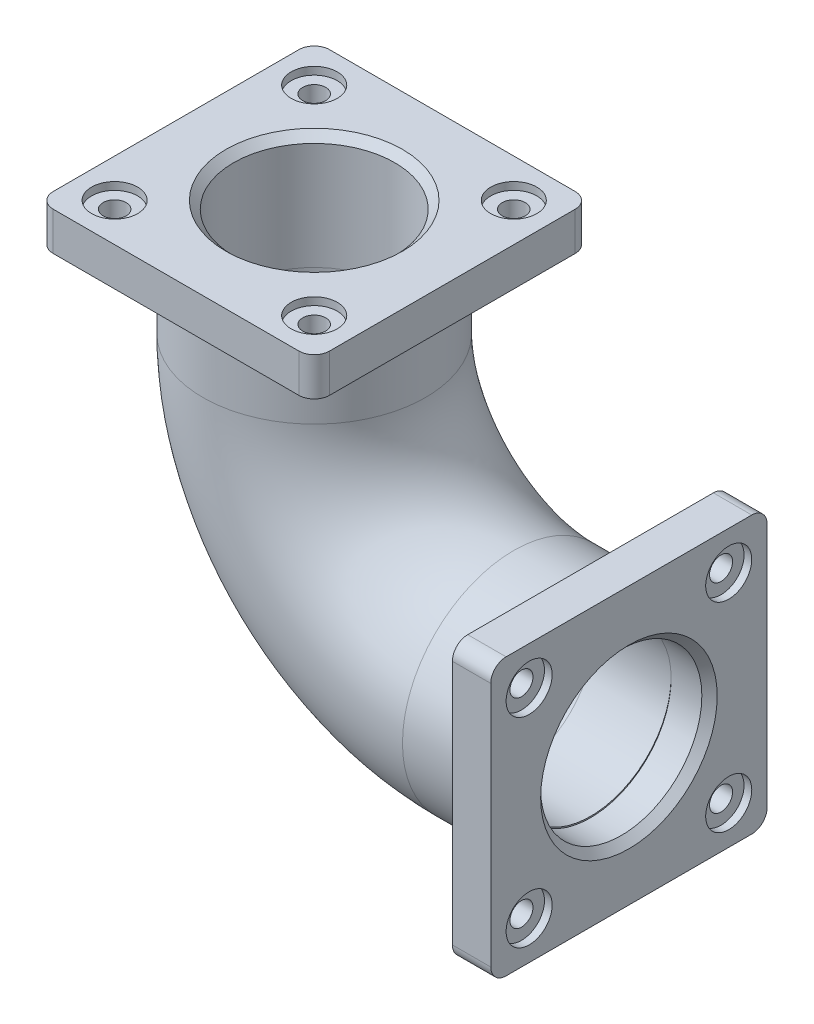
from build123d import *

# Parameters (mm, degrees)
SKETCH2_R           = 145
SKETCH2_R_2         = 105
SKETCH6_R           = 15
BOSS_EXTRUDE1_DEPTH = 50
SKETCH7_R           = 105
CUT_EXTRUDE1_DEPTH  = 50
SKETCH9_W           = 360
SKETCH9_H           = 360
SKETCH9_R           = 15
BOSS_EXTRUDE3_DEPTH = 50
SKETCH10_R          = 30
CUT_EXTRUDE3_DEPTH  = 10
SKETCH11_R          = 30
CUT_EXTRUDE4_DEPTH  = 10
FILLET2_R           = 20
FILLET3_R           = 10
SKETCH12_R          = 105
CUT_EXTRUDE5_DEPTH  = 50
CHAMFER2_SIZE       = 10


with BuildPart() as part:
    # Sweep1: sweep along a path in Sketch4
    with BuildLine(Plane.XY) as sweep1_path:
        Line((0, 0), (0, -150))
        ThreePointArc((0, -150), (76.152236891, -333.847763109), (260, -410))
        Line((260, -410), (410, -410))
    # Sketch2 → Sweep1 (sweep)
    with BuildSketch(Plane(origin=(0, 0, 0), x_dir=(1, 0, 0), z_dir=(0, 1, 0))):
        Circle(SKETCH2_R)
        Circle(SKETCH2_R_2, mode=Mode.SUBTRACT)
    sweep(path=sweep1_path.line)

    # Sketch6 → Boss-Extrude1 (add)
    with BuildSketch(Plane(origin=(0, 0, 0), x_dir=(1, 0, 0), z_dir=(0, 1, 0))):
        with BuildLine():
            Line((-160, 180), (160, 180))
            ThreePointArc((160, 180), (174.142135624, 174.142135624), (180, 160))
            Line((180, 160), (180, -160))
            ThreePointArc((180, -160), (174.142135624, -174.142135624), (160, -180))
            Line((160, -180), (-160, -180))
            ThreePointArc((-160, -180), (-174.142135624, -174.142135624), (-180, -160))
            Line((-180, -160), (-180, 160))
            ThreePointArc((-180, 160), (-174.142135624, 174.142135624), (-160, 180))
        make_face()
        with Locations(Location((-130, 130, 0), (0, 0, 270))):
            Circle(SKETCH6_R, mode=Mode.SUBTRACT)
        with Locations(Location((130, 130, 0), (0, 0, 270))):
            Circle(SKETCH6_R, mode=Mode.SUBTRACT)
        with Locations(Location((130, -130, 0), (0, 0, 270))):
            Circle(SKETCH6_R, mode=Mode.SUBTRACT)
        with Locations(Location((-130, -130, 0), (0, 0, 270))):
            Circle(SKETCH6_R, mode=Mode.SUBTRACT)
    extrude(amount=-BOSS_EXTRUDE1_DEPTH)

    # Sketch7 → Cut-Extrude1 (cut)
    with BuildSketch(Plane(origin=(0, -50, 0), x_dir=(-1, 0, 0), z_dir=(0, -1, 0))):
        with Locations(Location((0, 0, 0), (0, 0, 90))):
            Circle(SKETCH7_R)
    extrude(amount=-CUT_EXTRUDE1_DEPTH, mode=Mode.SUBTRACT)

    # Sketch9 → Boss-Extrude3 (add)
    with BuildSketch(Plane(origin=(410, 0, 0), x_dir=(0, 0, -1), z_dir=(1, 0, 0))):
        with Locations((0, -410)):
            Rectangle(SKETCH9_W, SKETCH9_H)
        with Locations((-130, -280)):
            Circle(SKETCH9_R, mode=Mode.SUBTRACT)
        with Locations((-130, -540)):
            Circle(SKETCH9_R, mode=Mode.SUBTRACT)
        with Locations((130, -540)):
            Circle(SKETCH9_R, mode=Mode.SUBTRACT)
        with Locations((130, -280)):
            Circle(SKETCH9_R, mode=Mode.SUBTRACT)
    extrude(amount=-BOSS_EXTRUDE3_DEPTH)

    # Sketch10 → Cut-Extrude3 (cut)
    with BuildSketch(Plane(origin=(0, 0, 0), x_dir=(1, 0, 0), z_dir=(0, 1, 0))):
        with Locations(Location((-130, 130, 0), (0, 0, 270))):
            Circle(SKETCH10_R)
        with Locations(Location((130, 130, 0), (0, 0, 270))):
            Circle(SKETCH10_R)
        with Locations(Location((130, -130, 0), (0, 0, 270))):
            Circle(SKETCH10_R)
        with Locations(Location((-130, -130, 0), (0, 0, 270))):
            Circle(SKETCH10_R)
    extrude(amount=-CUT_EXTRUDE3_DEPTH, mode=Mode.SUBTRACT)

    # Sketch11 → Cut-Extrude4 (cut)
    with BuildSketch(Plane(origin=(410, 0, 0), x_dir=(0, 0, -1), z_dir=(1, 0, 0))):
        with Locations((-130, -280)):
            Circle(SKETCH11_R)
        with Locations((130, -280)):
            Circle(SKETCH11_R)
        with Locations((-130, -540)):
            Circle(SKETCH11_R)
        with Locations((130, -540)):
            Circle(SKETCH11_R)
    extrude(amount=-CUT_EXTRUDE4_DEPTH, mode=Mode.SUBTRACT)

    # Fillet2
    fillet2_edges = [part.edges().sort_by_distance(p)[0] for p in [
        (385, -230, -180),
        (385, -590, -180),
        (385, -590, 180),
        (385, -230, 180),
    ]]
    fillet(fillet2_edges, radius=FILLET2_R)

    # Fillet3
    fillet3_edges = [part.edges().sort_by_distance(p)[0] for p in [
        (-145, -50, 0),
        (360, -555, 0),
    ]]
    fillet(fillet3_edges, radius=FILLET3_R)

    # Sketch12 → Cut-Extrude5 (cut)
    with BuildSketch(Plane(origin=(410, 0, 0), x_dir=(0, 0, -1), z_dir=(1, 0, 0))):
        with Locations((0, -411.649373871)):
            Circle(SKETCH12_R)
    extrude(amount=-CUT_EXTRUDE5_DEPTH, mode=Mode.SUBTRACT)

    # Chamfer2
    chamfer2_edges = [part.edges().sort_by_distance(p)[0] for p in [
        (410, -411.649373871, 105),
        (0, 0, 105),
    ]]
    chamfer(chamfer2_edges, length=CHAMFER2_SIZE)


solid = part.part
